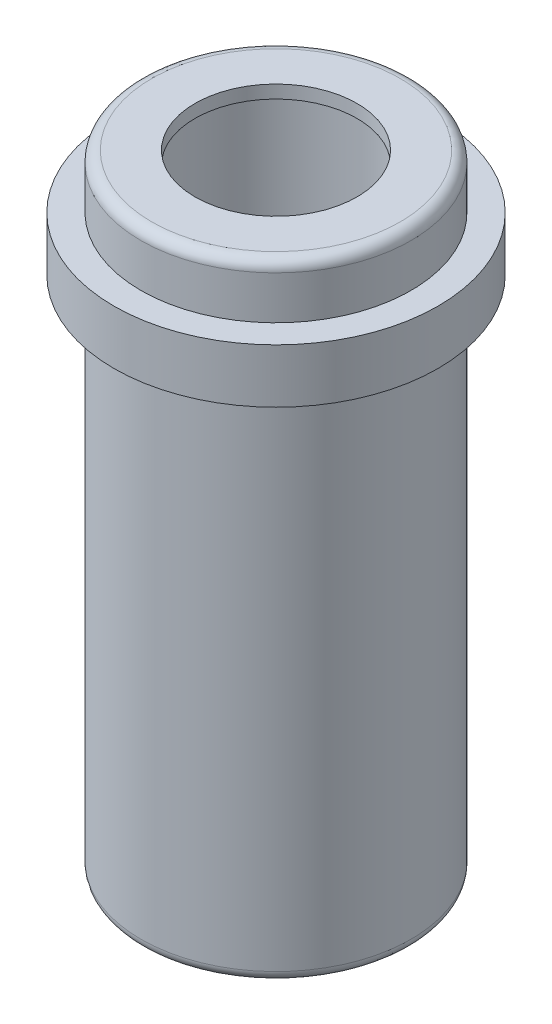
from build123d import *

# Parameters (mm, degrees)
FILLET_1_R = 0.1


with BuildPart() as part:
    # 草图1 → 旋转1 (revolve)
    with BuildSketch(Plane.XY, mode=Mode.PRIVATE) as revolve_1_sk:
        Polygon((0, -4.8), (-1.25, -4.8), (-1.25, 0), (-1.5, 0), (-1.5, 0.5), (-1.25, 0.5), (-1.25, 1), (-0.75, 1), (-0.75, 0.879741215), (-0.903225338, 0.879741215), (-0.903225338, -3.6), (0, -4.204142763), align=None)
    revolve(revolve_1_sk.sketch.rotate(Axis((0, 8.238789055, 0), (0, -1, 0)), 270), axis=Axis((0, 8.238789055, 0), (0, -1, 0)))

    # 圆角1
    fillet_1_edges = [part.edges().sort_by_distance(p)[0] for p in [
        (0, 1, -1.25),
        (0, -4.8, -1.25),
    ]]
    fillet(fillet_1_edges, radius=FILLET_1_R)


solid = part.part
